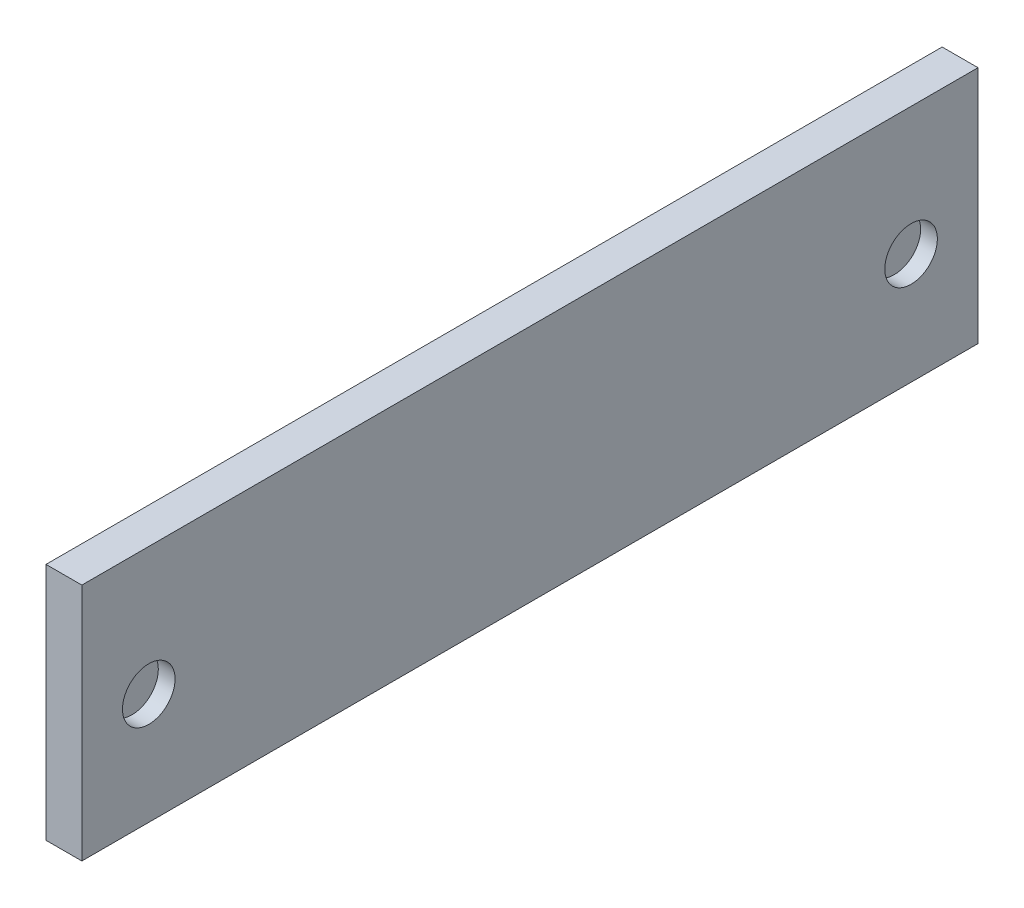
from build123d import *

# Parameters (mm, degrees)
CROQUIS1_W              = 375
CROQUIS1_H              = 100
SALIENTE_EXTRUIR1_DEPTH = 15
CROQUIS2_R              = 11
CORTAR_EXTRUIR1_DEPTH   = 7


with BuildPart() as part:
    # Croquis1 → Saliente-Extruir1 (new body)
    with BuildSketch(Plane(origin=(0, 0, 0), x_dir=(0, 0, -1), z_dir=(1, 0, 0))):
        with Locations((187.5, 50)):
            Rectangle(CROQUIS1_W, CROQUIS1_H)
    extrude(amount=SALIENTE_EXTRUIR1_DEPTH)

    # Croquis2 → Cortar-Extruir1 (cut)
    with BuildSketch(Plane(origin=(15, 0, 0), x_dir=(0, 0, -1), z_dir=(1, 0, 0))):
        with Locations((28, 46.5)):
            Circle(CROQUIS2_R)
        with Locations((347, 46.5)):
            Circle(CROQUIS2_R)
    extrude(amount=-CORTAR_EXTRUIR1_DEPTH, mode=Mode.SUBTRACT)


solid = part.part
